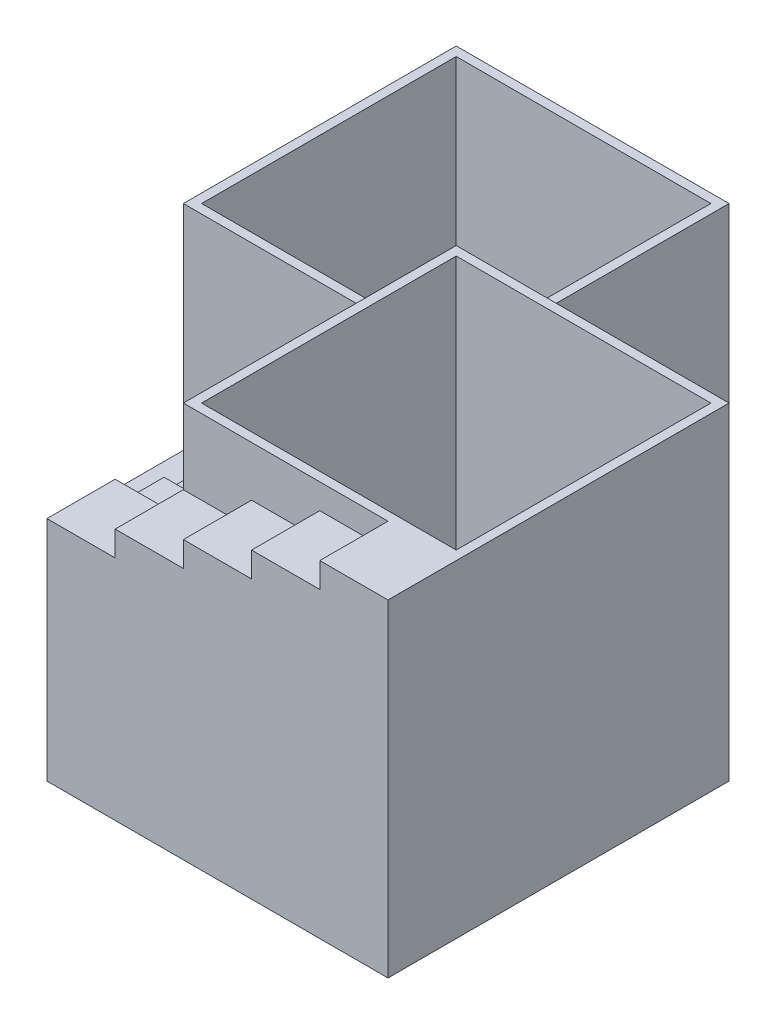
from build123d import *

# Parameters (mm, degrees)
BOSS_EXTRUDE1_DEPTH     = 2.54
SKETCH1_9_W             = 71.12
SKETCH1_9_H             = 71.12
BOSS_EXTRUDE3_DEPTH     = 63.5
SKETCH5_W               = 76.2
SKETCH5_H               = 76.2
SKETCH5_W_2             = 71.12
SKETCH5_H_2             = 71.12
BOSS_EXTRUDE4_DEPTH     = 25.4
BOSS_EXTRUDE7_DEPTH     = 19.05
BOSS_EXTRUDE11_DEPTH    = 19.05
SKETCH15_W              = 19.05
SKETCH15_H              = 6.35
BOSS_EXTRUDE12_DEPTH    = 19.05
SKETCH16_W              = 1.27
SKETCH16_H              = 12.7
CUT_EXTRUDE1_DEPTH      = 151.937776915
SKETCH17_W              = 6.35
SKETCH17_H              = 6.35
CUT_EXTRUDE2_DEPTH      = 25.4
CUT_EXTRUDE3_DEPTH      = 151.937776915
CUT_EXTRUDE3_DEPTH_BACK = 17.018
CUT_EXTRUDE4_DEPTH      = 162.394965845
CUT_EXTRUDE4_DEPTH_BACK = 12.7
SKETCH20_W              = 12.7
SKETCH20_H              = 2.54


with BuildPart() as part:
    # Sketch1 → Boss-Extrude1 (new body)
    with BuildSketch(Plane(origin=(0, 0, 0), x_dir=(1, 0, 0), z_dir=(0, 1, 0))):
        Polygon((-73.66, 73.66), (-73.66, -2.54), (0, -2.54), (0, -76.2), (76.2, -76.2), (76.2, 0), (2.54, 0), (2.54, 73.66), align=None)
    extrude(amount=-BOSS_EXTRUDE1_DEPTH)

    # Sketch1<9> → Boss-Extrude3 (add)
    with BuildSketch(Plane(origin=(0, 0, 0), x_dir=(1, 0, 0), z_dir=(0, 1, 0))):
        Polygon((2.54, 73.66), (-73.66, 73.66), (-73.66, -2.54), (0, -2.54), (0, -76.2), (76.2, -76.2), (76.2, 0), (2.54, 0), align=None)
        with Locations((38.1, -38.1)):
            Rectangle(SKETCH1_9_W, SKETCH1_9_H, mode=Mode.SUBTRACT)
        with Locations((-35.56, 35.56)):
            Rectangle(SKETCH1_9_W, SKETCH1_9_H, mode=Mode.SUBTRACT)
    extrude(amount=BOSS_EXTRUDE3_DEPTH)

    # Sketch5 → Boss-Extrude4 (add)
    with BuildSketch(Plane(origin=(0, 63.5, 0), x_dir=(1, 0, 0), z_dir=(0, 1, 0))):
        with Locations((38.1, -38.1)):
            Rectangle(SKETCH5_W, SKETCH5_H)
        with Locations((38.1, -38.1)):
            Rectangle(SKETCH5_W_2, SKETCH5_H_2, mode=Mode.SUBTRACT)
    extrude(amount=BOSS_EXTRUDE4_DEPTH)

    # Sketch9 → Boss-Extrude7 (add)
    with BuildSketch(Plane.XY.offset(2.54)):
        Polygon((-73.66, 3.81), (-73.66, -2.54), (0, -2.54), (0, 29.21), (-19.05, 29.21), (-19.05, 22.86), (-32.7025, 22.86), (-32.7025, 16.51), (-46.355, 16.51), (-46.355, 10.16), (-60.0075, 10.16), (-60.0075, 3.81), align=None)
    extrude(amount=BOSS_EXTRUDE7_DEPTH)

    # Sketch11 → Boss-Extrude11 (add)
    with BuildSketch(Plane.ZY):
        Polygon((76.2, 29.21), (21.59, 29.21), (21.59, 0), (21.59, -2.54), (76.2, -2.54), (76.2, 0), align=None)
        Polygon((21.59, 35.56), (21.59, 29.21), (76.2, 29.21), (76.2, 48.26), (76.2, 54.61), (62.5475, 54.61), (62.5475, 48.26), (48.895, 48.26), (48.895, 41.91), (35.2425, 41.91), (35.2425, 35.56), align=None)
    extrude(amount=BOSS_EXTRUDE11_DEPTH)

    # Sketch15 → Boss-Extrude12 (add)
    with BuildSketch(Plane.XY.offset(76.2)):
        Polygon((0, 60.96), (76.2, 60.96), (76.2, 88.9), (57.15, 88.9), (57.15, 81.915), (38.1, 81.915), (38.1, 74.93), (19.05, 74.93), (19.05, 67.945), (0, 67.945), align=None)
        Polygon((-19.05, 54.61), (-19.05, -2.54), (76.2, -2.54), (76.2, 60.96), (0, 60.96), (0, 54.61), align=None)
        with Locations((-9.525, 57.785)):
            Rectangle(SKETCH15_W, SKETCH15_H)
    extrude(amount=BOSS_EXTRUDE12_DEPTH)

    # Sketch16 → Cut-Extrude1 (cut, through all)
    with BuildSketch(Plane(origin=(0, 0, 0), x_dir=(1, 0, 0), z_dir=(0, 1, 0))):
        with Locations((-41.91, 25.185614026)):
            Rectangle(SKETCH16_W, SKETCH16_H)
        with Locations((-41.91, 39.37)):
            Rectangle(SKETCH16_W, SKETCH16_H)
        with Locations((-36.195, 39.37)):
            Rectangle(SKETCH16_W, SKETCH16_H)
        with Locations((-30.48, 39.37)):
            Rectangle(SKETCH16_W, SKETCH16_H)
        with Locations((-36.195, 25.185614026)):
            Rectangle(SKETCH16_W, SKETCH16_H)
        with Locations((-30.48, 25.185614026)):
            Rectangle(SKETCH16_W, SKETCH16_H)
        with Locations((19.685, -37.465)):
            Rectangle(SKETCH16_W, SKETCH16_H)
        with Locations((25.4, -37.465)):
            Rectangle(SKETCH16_W, SKETCH16_H)
        with Locations((31.115, -37.465)):
            Rectangle(SKETCH16_W, SKETCH16_H)
        with Locations((45.085, -37.465)):
            Rectangle(SKETCH16_W, SKETCH16_H)
        with Locations((50.8, -37.465)):
            Rectangle(SKETCH16_W, SKETCH16_H)
        with Locations((56.515, -37.465)):
            Rectangle(SKETCH16_W, SKETCH16_H)
    extrude(amount=-CUT_EXTRUDE1_DEPTH, mode=Mode.SUBTRACT)

    # Sketch17 → Cut-Extrude2 (cut)
    with BuildSketch(Plane.XZ.offset(2.54)):
        with Locations((-6.985, 12.065)):
            Rectangle(SKETCH17_W, SKETCH17_H)
        with Locations((-6.985, 85.725)):
            Rectangle(SKETCH17_W, SKETCH17_H)
        with Locations((66.675, 85.725)):
            Rectangle(SKETCH17_W, SKETCH17_H)
    extrude(amount=-CUT_EXTRUDE2_DEPTH, mode=Mode.SUBTRACT)

    # Sketch19 → Cut-Extrude3 (cut, two sides: drawn at the far end of the back side and taken through both)
    with BuildSketch(Plane.XY.offset(21.59).offset(-CUT_EXTRUDE3_DEPTH_BACK)):
        Polygon((-29.845, -312.284215123), (-29.845, -2.54), (-29.845, 0), (-42.545, 0), (-42.545, -2.54), (-42.545, -312.284215123), (-42.545, -931.77264537), (-29.845, -931.77264537), align=None)
    extrude(amount=CUT_EXTRUDE3_DEPTH + CUT_EXTRUDE3_DEPTH_BACK, mode=Mode.SUBTRACT)

    # Sketch20 → Cut-Extrude4 (cut, two sides: drawn at the far end of the back side and taken through both)
    with BuildSketch(Plane.ZY.offset(19.05).offset(-CUT_EXTRUDE4_DEPTH_BACK)):
        with Locations((37.465, -1.27)):
            Rectangle(SKETCH20_W, SKETCH20_H)
    extrude(amount=CUT_EXTRUDE4_DEPTH + CUT_EXTRUDE4_DEPTH_BACK, mode=Mode.SUBTRACT)


solid = part.part
